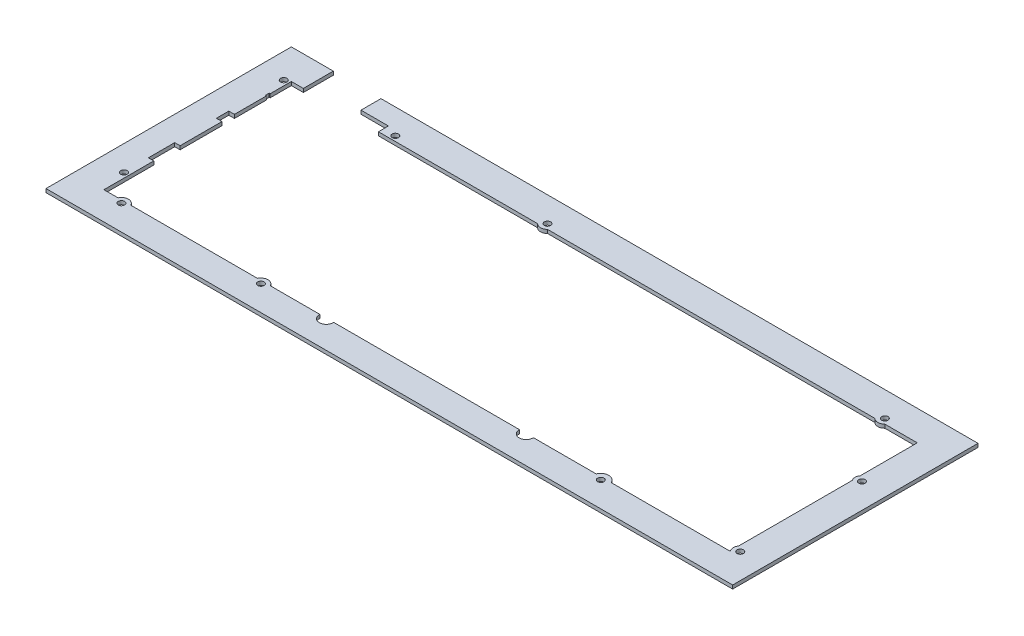
from build123d import *

# Parameters (mm, degrees)
SKETCH_3_R      = 1.6
EXTRUDE_1_DEPTH = 1.8


with BuildPart() as part:
    # 草图3 → 凸台-拉伸1 (new body)
    with BuildSketch(Plane(origin=(0, 0, 0), x_dir=(1, 0, 0), z_dir=(0, 1, 0))):
        with BuildLine():
            Line((-44.29, 110.33), (-23.2864152, 110.33))
            Line((-23.2864152, 110.33), (-23.2864152, 95.33))
            Line((-23.2864152, 95.33), (-29.29, 95.33))
            Line((-29.29, 95.33), (-29.29, 84.723605))
            Line((-29.29, 84.723605), (-29.79, 84.723605))
            Line((-29.79, 84.723605), (-29.79, 82.916395))
            Line((-29.79, 82.916395), (-29.29, 82.916395))
            Line((-29.29, 82.916395), (-29.29, 66.81327125))
            Line((-29.29, 66.81327125), (-32.110172, 66.81327125))
            Line((-32.110172, 66.81327125), (-32.110172, 60.6000312))
            Line((-32.110172, 60.6000312), (-29.29, 60.6000312))
            Line((-29.29, 60.6000312), (-29.29, 39.6))
            Line((-29.29, 39.6), (-31.98, 39.6))
            Line((-31.98, 39.6), (-31.98, 26.44))
            Line((-31.98, 26.44), (-29.29, 26.44))
            Line((-29.29, 26.44), (-29.29, 1.46))
            Line((-29.29, 1.46), (-22.230943256, 1.46))
            ThreePointArc((-22.230943256, 1.46), (-19.05, 3.5), (-15.869056744, 1.46))
            Line((-15.869056744, 1.46), (47.619040111, 1.46))
            ThreePointArc((47.619040111, 1.46), (50.7999886, 3.5000114), (53.980937089, 1.46))
            Line((53.980937089, 1.46), (78.840703168, 1.46))
            ThreePointArc((78.840703168, 1.46), (82.3341, -2.254892), (85.827496832, 1.46))
            Line((85.827496832, 1.46), (178.872422541, 1.46))
            ThreePointArc((178.872422541, 1.46), (182.3339, -2.2230334), (185.795377459, 1.46))
            Line((185.795377459, 1.46), (217.255954056, 1.46))
            ThreePointArc((217.255954056, 1.46), (220.9799886, 4.0000114), (224.704023144, 1.46))
            Line((224.704023144, 1.46), (284.147, 1.46))
            Line((284.147, 1.46), (284.147, 1.811027532))
            ThreePointArc((284.147, 1.811027532), (283.5199886, 3.8100114), (284.147, 5.808995268))
            Line((284.147, 5.808995268), (284.147, 62.771027532))
            ThreePointArc((284.147, 62.771027532), (283.5199886, 64.7700114), (284.147, 66.768995268))
            Line((284.147, 66.768995268), (284.147, 95.33))
            Line((284.147, 95.33), (267.919635947, 95.33))
            ThreePointArc((267.919635947, 95.33), (265.4299886, 94.2900114), (262.940341253, 95.33))
            Line((262.940341253, 95.33), (99.009635947, 95.33))
            ThreePointArc((99.009635947, 95.33), (96.5199886, 94.2900114), (94.030341253, 95.33))
            Line((94.030341253, 95.33), (14.32, 95.33))
            Line((14.32, 95.33), (14.32, 100.33))
            Line((14.32, 100.33), (0.5819962, 100.33))
            Line((0.5819962, 100.33), (0.5819962, 110.33))
            Line((0.5819962, 110.33), (299.56, 110.33))
            Line((299.56, 110.33), (299.56, -12.54))
            Line((299.56, -12.54), (-44.29, -12.54))
            Line((-44.29, -12.54), (-44.29, 110.33))
        make_face()
        with Locations((-31.75, 93.98)):
            Circle(SKETCH_3_R, mode=Mode.SUBTRACT)
        with Locations((20.32, 97.79)):
            Circle(SKETCH_3_R, mode=Mode.SUBTRACT)
        with Locations((96.5199886, 97.7900114)):
            Circle(SKETCH_3_R, mode=Mode.SUBTRACT)
        with Locations((265.4299886, 97.7900114)):
            Circle(SKETCH_3_R, mode=Mode.SUBTRACT)
        with Locations((287.0199886, 64.7700114)):
            Circle(SKETCH_3_R, mode=Mode.SUBTRACT)
        with Locations((287.0199886, 3.8100114)):
            Circle(SKETCH_3_R, mode=Mode.SUBTRACT)
        with Locations((220.9799886, 1.14e-05)):
            Circle(SKETCH_3_R, mode=Mode.SUBTRACT)
        with Locations((50.7999886, 1.14e-05)):
            Circle(SKETCH_3_R, mode=Mode.SUBTRACT)
        with Locations((-19.05, 0)):
            Circle(SKETCH_3_R, mode=Mode.SUBTRACT)
        with Locations((-31.75, 13.97)):
            Circle(SKETCH_3_R, mode=Mode.SUBTRACT)
    extrude(amount=-EXTRUDE_1_DEPTH)


solid = part.part
